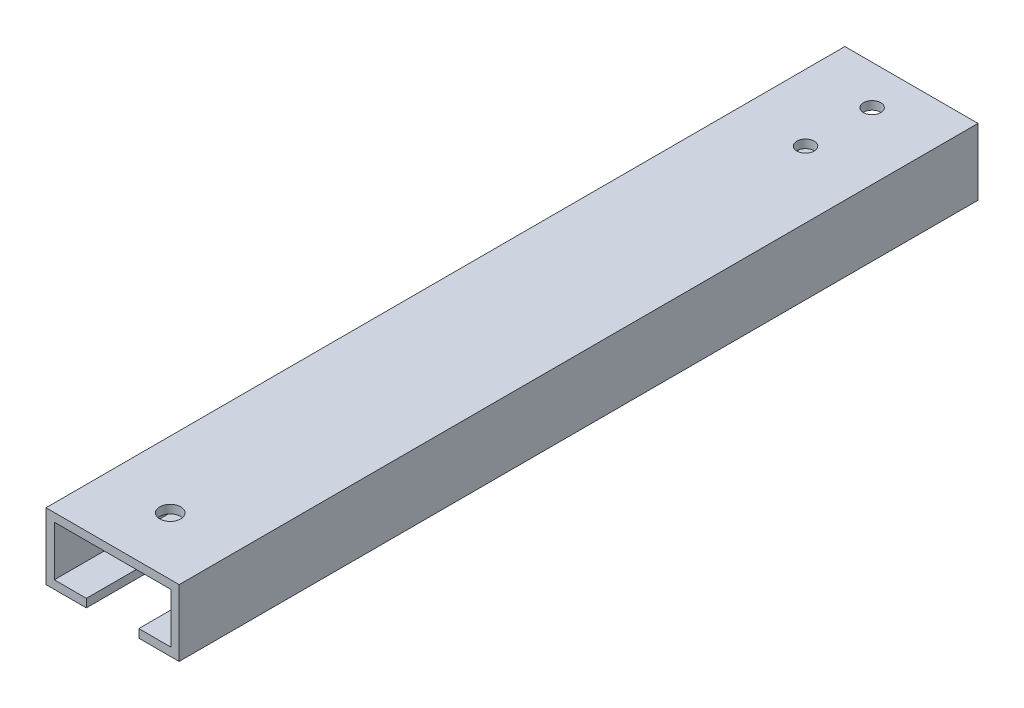
from build123d import *

# Parameters (mm, degrees)
SKETCH3_W               = 25.4
SKETCH3_H               = 12.7
SKETCH3_W_2             = 22.225
SKETCH3_H_2             = 9.525
BOSS_EXTRUDE1_DEPTH     = 152.4
SKETCH4_R               = 2
CUT_EXTRUDE1_DEPTH      = 1.5875
SKETCH5_R               = 1.500419334
CUT_EXTRUDE2_DEPTH      = 1.5875
CUT_EXTRUDE3_DEPTH      = 154.454683865
CUT_EXTRUDE3_DEPTH_BACK = 2.54
M4X0_7_TAPPED_HOLE1_D   = 3.3


with BuildPart() as part:
    # Sketch3 → Boss-Extrude1 (new body)
    with BuildSketch(Plane.XY):
        Rectangle(SKETCH3_W, SKETCH3_H)
        Rectangle(SKETCH3_W_2, SKETCH3_H_2, mode=Mode.SUBTRACT)
    extrude(amount=BOSS_EXTRUDE1_DEPTH)

    # Sketch4 → Cut-Extrude1 (cut)
    with BuildSketch(Plane(origin=(0, 6.35, 0), x_dir=(1, 0, 0), z_dir=(0, 1, 0))):
        with Locations(Location((0, -141.4, 0), (0, 0, 270))):
            Circle(SKETCH4_R)
    extrude(amount=-CUT_EXTRUDE1_DEPTH, mode=Mode.SUBTRACT)

    # Sketch5 → Cut-Extrude2 (cut)
    with BuildSketch(Plane.XZ.offset(6.35)):
        with Locations((-8, 141.4)):
            Circle(SKETCH5_R)
        with Locations((0, 149.4)):
            Circle(SKETCH5_R)
        with Locations((8, 141.4)):
            Circle(SKETCH5_R)
    extrude(amount=-CUT_EXTRUDE2_DEPTH, mode=Mode.SUBTRACT)

    # Sketch6 → Cut-Extrude3 (cut, two sides: drawn at the far end of the back side and taken through both)
    with BuildSketch(Plane.XZ.offset(6.35).offset(-CUT_EXTRUDE3_DEPTH_BACK)):
        Polygon((-5, 469.248822712), (-5, 152.4), (-5, 136.4), (5, 136.4), (5, 152.4), (5, 469.248822712), (5, 1102.946468137), (-5, 1102.946468137), align=None)
    extrude(amount=CUT_EXTRUDE3_DEPTH + CUT_EXTRUDE3_DEPTH_BACK, mode=Mode.SUBTRACT)

    # M4x0.7 Tapped Hole1 (through all)
    with Locations(Plane(origin=(0, -6.35, 0), x_dir=(-1, 0, 0), z_dir=(0, -1, 0))):
        with Locations((0, -20.199999986), (0, -7.5)):
            Hole(M4X0_7_TAPPED_HOLE1_D / 2)


solid = part.part
